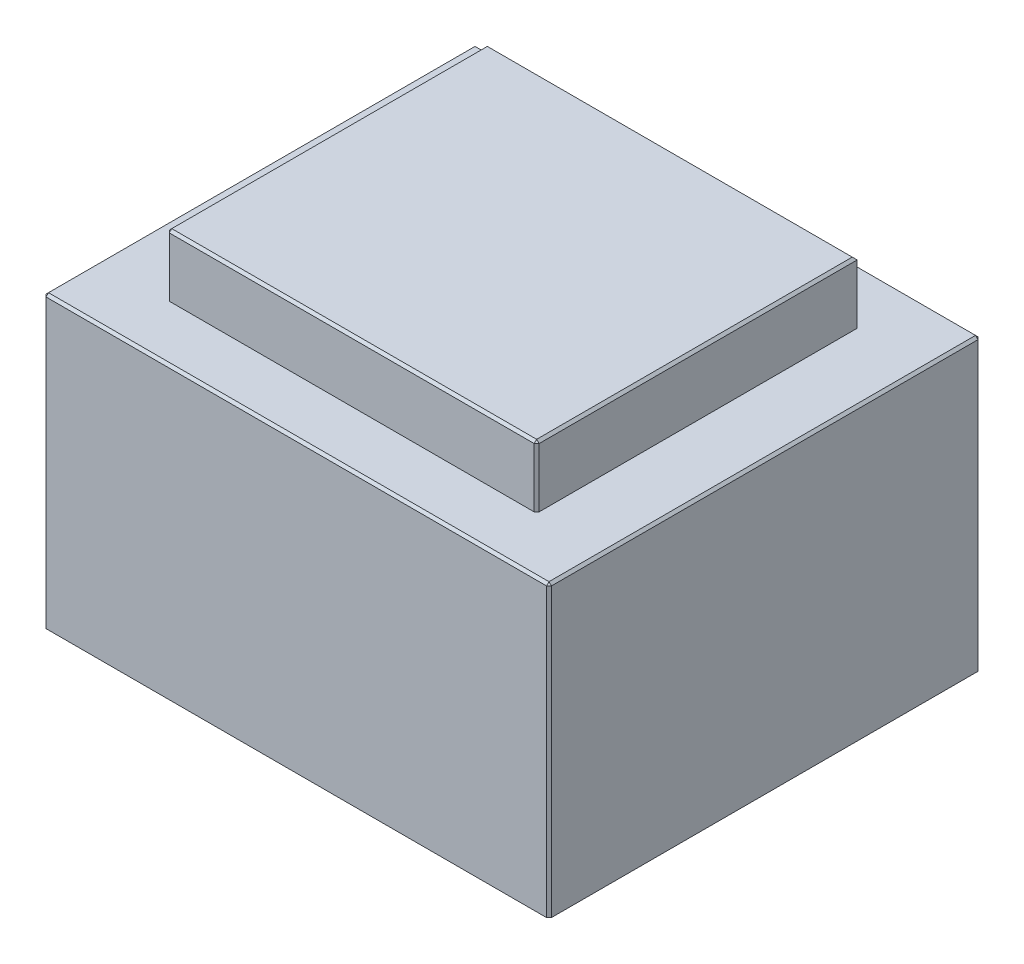
from build123d import *

# Parameters (mm, degrees)
SKETCH2_W           = 41
SKETCH2_H           = 35
BOSS_EXTRUDE1_DEPTH = 23.5
SKETCH3_W           = 30
SKETCH3_H           = 26
BOSS_EXTRUDE2_DEPTH = 5
SKETCH4_R           = 0.4
BOSS_EXTRUDE3_DEPTH = 2.5
CHAMFER1_SIZE       = 0.2


with BuildPart() as part:
    # Sketch2 → Boss-Extrude1 (new body)
    with BuildSketch(Plane(origin=(0, 0, 0), x_dir=(1, 0, 0), z_dir=(0, 1, 0))):
        Rectangle(SKETCH2_W, SKETCH2_H)
    extrude(amount=BOSS_EXTRUDE1_DEPTH)

    # Sketch3 → Boss-Extrude2 (add)
    with BuildSketch(Plane(origin=(0, 23.5, 0), x_dir=(1, 0, 0), z_dir=(0, 1, 0))):
        Rectangle(SKETCH3_W, SKETCH3_H)
    extrude(amount=BOSS_EXTRUDE2_DEPTH)

    # Sketch4 → Boss-Extrude3 (add)
    with BuildSketch(Plane.XZ):
        with Locations(Location((-10, 12.5, 0), (0, 0, 90))):
            Circle(SKETCH4_R)
        with Locations(Location((10, 12.5, 0), (0, 0, 90))):
            Circle(SKETCH4_R)
        with Locations(Location((-5, -12.5, 0), (0, 0, 90))):
            Circle(SKETCH4_R)
        with Locations(Location((5, -12.5, 0), (0, 0, 90))):
            Circle(SKETCH4_R)
    extrude(amount=BOSS_EXTRUDE3_DEPTH)

    # Chamfer1
    chamfer1_edges = [part.edges().sort_by_distance(p)[0] for p in [
        (20.5, 23.5, 0),
        (0, 23.5, -17.5),
        (15, 26, 13),
        (-15, 26, -13),
        (-15, 26, 13),
        (15, 28.5, 0),
        (0, 28.5, -13),
        (-15, 28.5, 0),
        (0, 28.5, 13),
        (-20.5, 23.5, 0),
        (0, 23.5, 17.5),
        (-20.5, 11.75, -17.5),
        (20.5, 11.75, -17.5),
        (20.5, 11.75, 17.5),
        (-20.5, 11.75, 17.5),
    ]]
    chamfer(chamfer1_edges, length=CHAMFER1_SIZE)


solid = part.part
